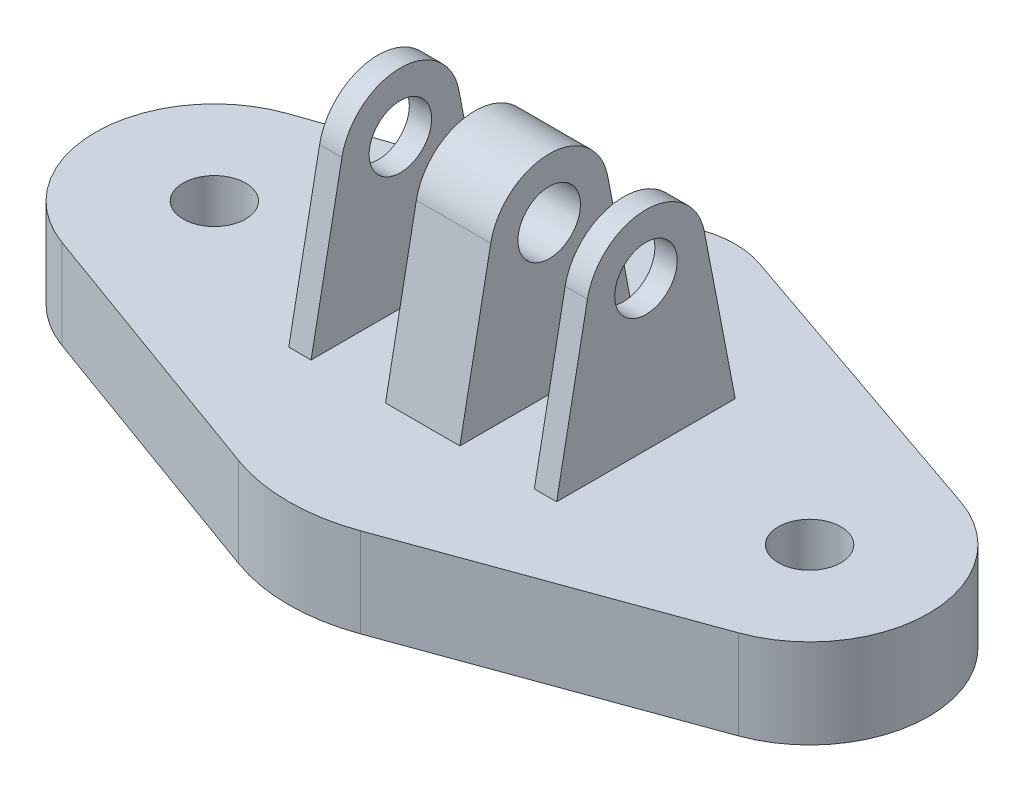
from build123d import *

# Parameters (mm, degrees)
SKETCH1_R           = 2.1
BOSS_EXTRUDE1_DEPTH = 6
SKETCH2_R           = 2.1
BOSS_EXTRUDE2_DEPTH = 9
SKETCH3_W           = 5
SKETCH3_H           = 28
CUT_EXTRUDE1_DEPTH  = 38.536648758


with BuildPart() as part:
    # Sketch1 → Boss-Extrude1 (new body)
    with BuildSketch(Plane(origin=(0, 0, 0), x_dir=(1, 0, 0), z_dir=(0, 1, 0))):
        with BuildLine():
            Line((22.603957871, 7.564350825), (1.952968403, 14.673263119))
            ThreePointArc((1.952968403, 14.673263119), (0.990055879, 14.917752053), (0, 15))
            Line((0, 15), (0, -15))
            ThreePointArc((0, -15), (2.077420969, -14.818812213), (4.092108053, -14.280720353))
            Line((4.092108053, -14.280720353), (22.728072035, -7.520480235))
            ThreePointArc((22.728072035, -7.520480235), (27.999729231, 0.065819743), (22.603957871, 7.564350825))
        make_face()
        with Locations(Location((20, 0, 0), (0, 0, 270))):
            Circle(SKETCH1_R, mode=Mode.SUBTRACT)
    boss_extrude1 = extrude(amount=BOSS_EXTRUDE1_DEPTH)

    # Mirror1: Boss-Extrude1 across plane
    add(boss_extrude1.mirror(Plane(origin=(0, 6, -15), x_dir=(0, 0, 1), z_dir=(1, 0, 0))))

    # Sketch2 → Boss-Extrude2 (add, symmetric)
    with BuildSketch(Plane(origin=(0, 0, 0), x_dir=(0, 0, -1), z_dir=(1, 0, 0))):
        with BuildLine():
            Line((-6, 6), (-3.92777975, 16.75666785))
            ThreePointArc((-3.92777975, 16.75666785), (0, 20), (3.92777975, 16.75666785))
            Line((3.92777975, 16.75666785), (6, 6))
            Line((6, 6), (-6, 6))
        make_face()
        with Locations((0, 16)):
            Circle(SKETCH2_R, mode=Mode.SUBTRACT)
    extrude(amount=BOSS_EXTRUDE2_DEPTH, both=True)

    # Sketch3 → Cut-Extrude1 (cut, symmetric)
    with BuildSketch(Plane.XY):
        with Locations((-5, 20)):
            Rectangle(SKETCH3_W, SKETCH3_H)
    cut_extrude1 = extrude(amount=CUT_EXTRUDE1_DEPTH, both=True, mode=Mode.SUBTRACT)

    # Mirror2: Cut-Extrude1 across plane
    add(cut_extrude1.mirror(Plane(origin=(0, 0, 0), x_dir=(0, 0, 1), z_dir=(1, 0, 0))), mode=Mode.SUBTRACT)


solid = part.part
